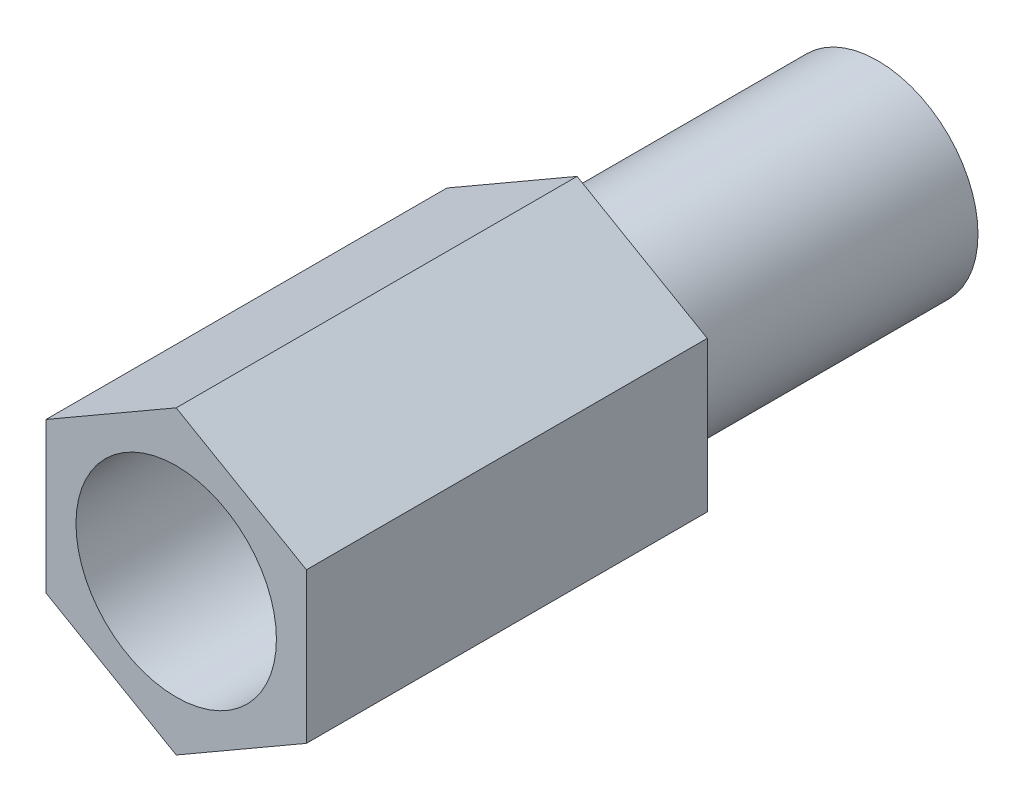
from build123d import *

# Parameters (mm, degrees)
EXTRUDE_1_DEPTH     = 8
SKETCH_2_R          = 2
CUT_EXTRUDE_1_DEPTH = 6
SKETCH_3_R          = 2
EXTRUDE_2_DEPTH     = 6


with BuildPart() as part:
    # 草图1 → 凸台-拉伸1 (new body)
    with BuildSketch(Plane.XY):
        Polygon((0, 3), (-2.598076211, 1.5), (-2.598076211, -1.5), (0, -3), (2.598076211, -1.5), (2.598076211, 1.5), align=None)
    extrude(amount=EXTRUDE_1_DEPTH)

    # 草图2 → 切除-拉伸1 (cut)
    with BuildSketch(Plane.XY.offset(8)):
        Circle(SKETCH_2_R)
    extrude(amount=-CUT_EXTRUDE_1_DEPTH, mode=Mode.SUBTRACT)

    # 草图3 → 凸台-拉伸2 (add)
    with BuildSketch(Plane(origin=(0, 0, 0), x_dir=(-1, 0, 0), z_dir=(0, 0, -1))):
        with Locations(Location((0, 0, 0), (0, 0, 180))):
            Circle(SKETCH_3_R)
    extrude(amount=EXTRUDE_2_DEPTH)


solid = part.part
